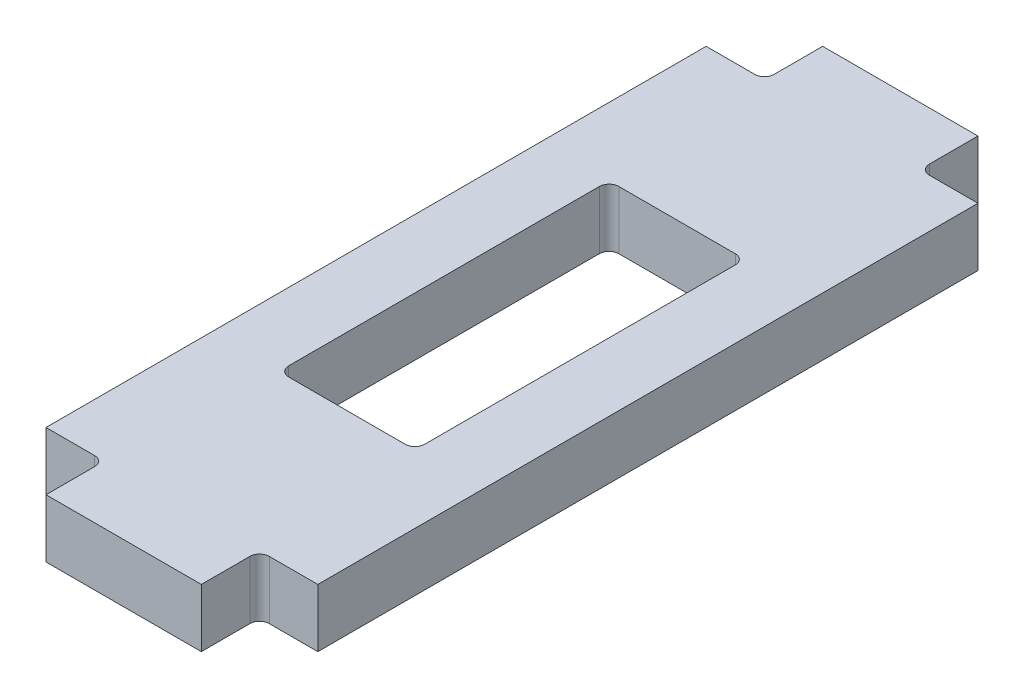
from build123d import *

# Parameters (mm, degrees)
SKETCH_1_W      = 7
SKETCH_1_H      = 17
SKETCH_1_W_2    = 8
SKETCH_1_H_2    = 3
EXTRUDE_1_DEPTH = 3
FILLET_1_R      = 0.5


with BuildPart() as part:
    # 草图1 → 凸台-拉伸1 (new body)
    # profile 1 of 5: a face of its own
    with BuildSketch(Plane(origin=(0, 0, 0), x_dir=(1, 0, 0), z_dir=(0, 1, 0))):
        Polygon((-4, 17), (-7, 17), (-7, -17), (-4, -17), (-4, -14), (4, -14), (4, -17), (7, -17), (7, 17), (4, 17), (4, 14), (-4, 14), align=None)
        Rectangle(SKETCH_1_W, SKETCH_1_H, mode=Mode.SUBTRACT)
    # profile 2 of 5: a face of its own
    with BuildSketch(Plane(origin=(0, 0, 0), x_dir=(1, 0, 0), z_dir=(0, 1, 0))):
        with Locations((0, 18.5)):
            Rectangle(SKETCH_1_W_2, SKETCH_1_H_2)
    # profile 3 of 5: a face of its own
    with BuildSketch(Plane(origin=(0, 0, 0), x_dir=(1, 0, 0), z_dir=(0, 1, 0))):
        with Locations((0, 15.5)):
            Rectangle(SKETCH_1_W_2, SKETCH_1_H_2)
    # profile 4 of 5: a face of its own
    with BuildSketch(Plane(origin=(0, 0, 0), x_dir=(1, 0, 0), z_dir=(0, 1, 0))):
        with Locations((0, -18.5)):
            Rectangle(SKETCH_1_W_2, SKETCH_1_H_2)
    # profile 5 of 5: a face of its own
    with BuildSketch(Plane(origin=(0, 0, 0), x_dir=(1, 0, 0), z_dir=(0, 1, 0))):
        with Locations((0, -15.5)):
            Rectangle(SKETCH_1_W_2, SKETCH_1_H_2)
    extrude(amount=EXTRUDE_1_DEPTH)

    # 圆角1
    fillet_1_edges = [part.edges().sort_by_distance(p)[0] for p in [
        (-3.5, 1.5, -8.5),
        (-3.5, 1.5, 8.5),
        (3.5, 1.5, 8.5),
        (3.5, 1.5, -8.5),
        (-4, 1.5, -17),
        (4, 1.5, -17),
        (4, 1.5, 17),
        (-4, 1.5, 17),
    ]]
    fillet(fillet_1_edges, radius=FILLET_1_R)


solid = part.part
